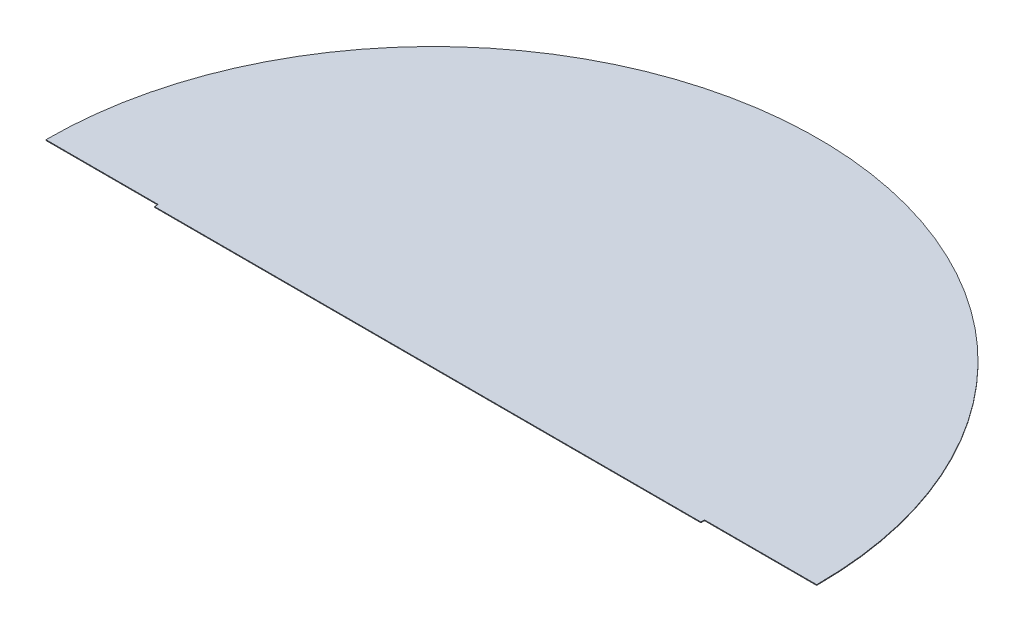
from build123d import *

# Parameters (mm, degrees)
BOSS_EXTRUDE1_DEPTH = 2


with BuildPart() as part:
    # Sketch1 → Boss-Extrude1 (new body)
    with BuildSketch(Plane(origin=(0, 0, 0), x_dir=(1, 0, 0), z_dir=(0, 1, 0))):
        with BuildLine():
            Line((0, 0), (0, -5))
            Line((0, -5), (310, -5))
            Line((310, -5), (310, -15))
            Line((310, -15), (1820, -15))
            Line((1820, -15), (1820, -5))
            Line((1820, -5), (2130, -5))
            Line((2130, -5), (2130, 0))
            ThreePointArc((2130, 0), (1065, 1065), (0, 0))
        make_face()
    extrude(amount=BOSS_EXTRUDE1_DEPTH)


solid = part.part
